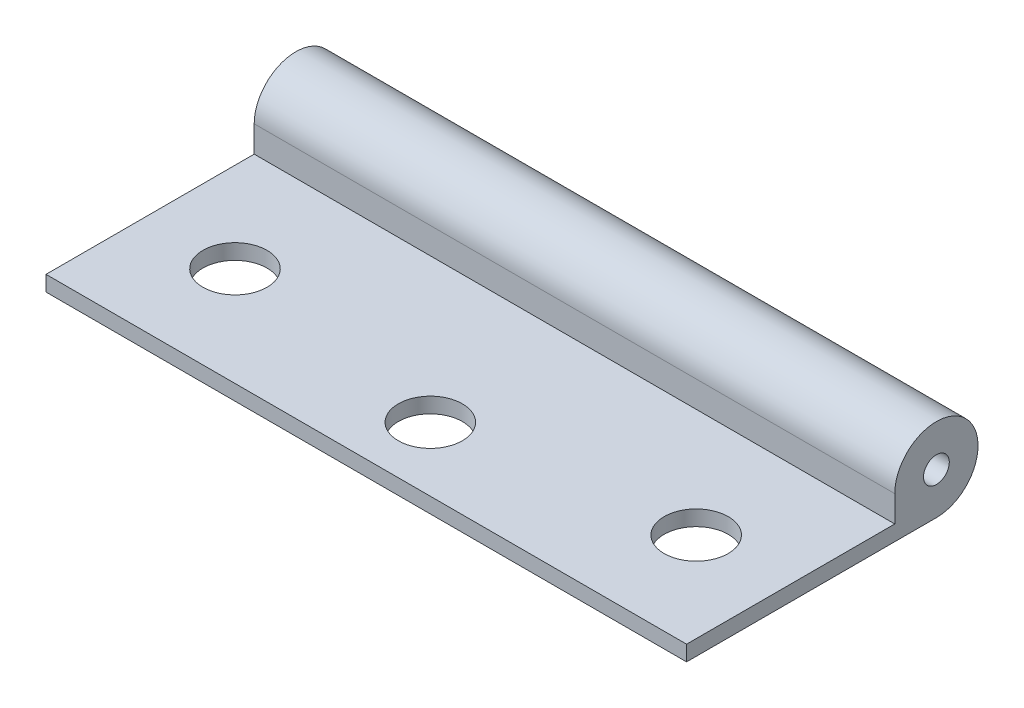
from build123d import *

# Parameters (mm, degrees)
SKETCH_1_W      = 50
SKETCH_1_H      = 16.25
SKETCH_1_R      = 2.5
EXTRUDE_1_DEPTH = 1.2
SKETCH_2_R      = 1.005653766
EXTRUDE_2_DEPTH = 50


with BuildPart() as part:
    # 草图1 → 凸台-拉伸1 (new body)
    with BuildSketch(Plane(origin=(0, 0, 0), x_dir=(1, 0, 0), z_dir=(0, 1, 0))):
        with Locations((25, -8.125)):
            Rectangle(SKETCH_1_W, SKETCH_1_H)
        with Locations(Location((7, -8.5, 0), (0, 0, 270))):
            Circle(SKETCH_1_R, mode=Mode.SUBTRACT)
        with Locations(Location((43, -8.5, 0), (0, 0, 270))):
            Circle(SKETCH_1_R, mode=Mode.SUBTRACT)
        with Locations(Location((25, -11.25, 0), (0, 0, 270))):
            Circle(SKETCH_1_R, mode=Mode.SUBTRACT)
    extrude(amount=EXTRUDE_1_DEPTH)

    # 草图2 → 凸台-拉伸2 (add)
    with BuildSketch(Plane.ZY):
        with BuildLine():
            Line((0, 0), (-3.25, 0))
            ThreePointArc((-3.25, 0), (-5.548097039, 5.548097039), (0, 3.25))
            Line((0, 3.25), (0, 0))
        make_face()
        with Locations((-3.25, 3.25)):
            Circle(SKETCH_2_R, mode=Mode.SUBTRACT)
    extrude(amount=-EXTRUDE_2_DEPTH)


solid = part.part
